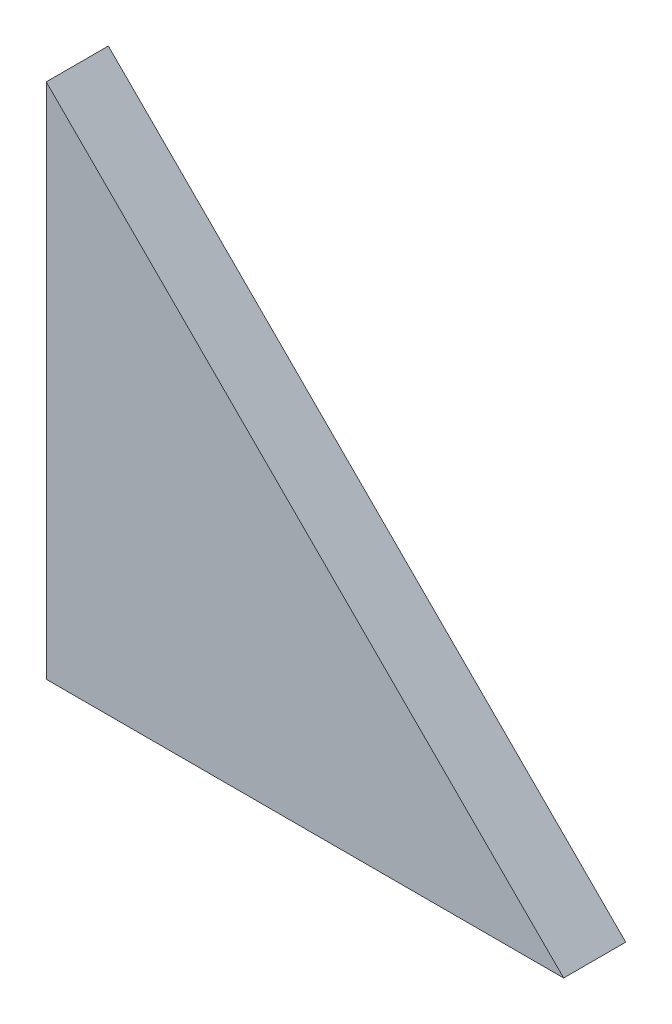
from build123d import *

# Parameters (mm, degrees)
SALIENTE_EXTRUIR1_DEPTH = 1.5


with BuildPart() as part:
    # Croquis1 → Saliente-Extruir1 (new, symmetric)
    with BuildSketch(Plane.XY):
        Polygon((0, 25), (25, 0), (0, 0), align=None)
    extrude(amount=SALIENTE_EXTRUIR1_DEPTH, both=True)


solid = part.part
